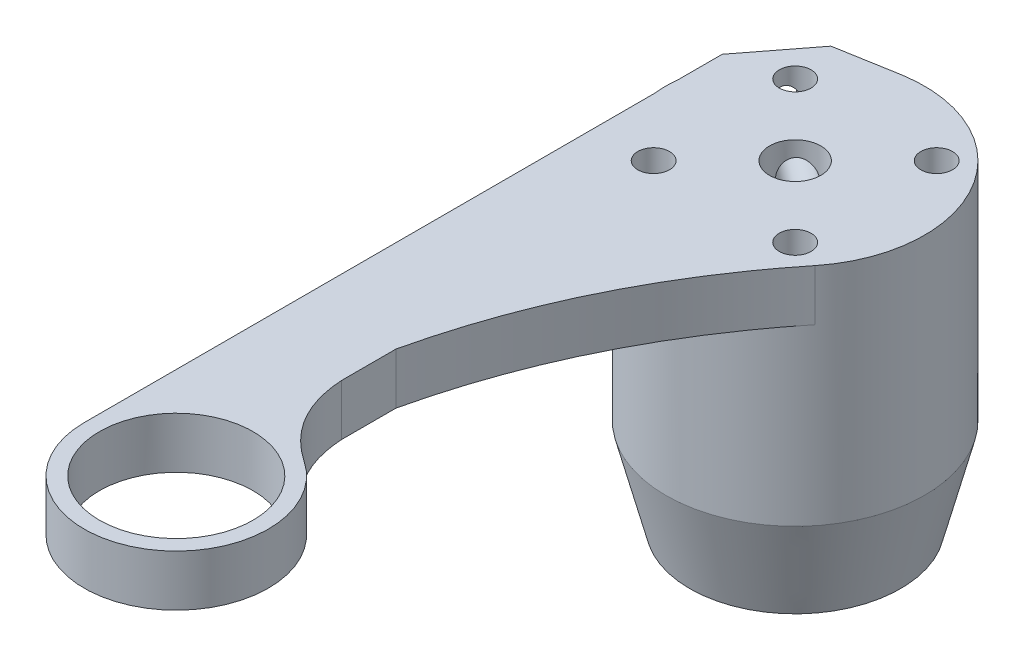
from build123d import *

# Parameters (mm, degrees)
DODANIE_WYCI_GNI_CIE1_DEPTH = 5
DODANIE_WYCI_GNI_CIE2_START = 17
SZKIC3_R                    = 12.625
DODANIE_WYCI_GNI_CIE2_DEPTH = 17
SZKIC4_R                    = 2.5
SZKIC4_R_2                  = 1.55
WYTNIJ_WYCI_GNI_CIE1_DEPTH  = 25
SZKIC5_R                    = 3.75
WYTNIJ_WYCI_GNI_CIE2_DEPTH  = 7.5
DODANIE_WYCI_GNI_CIE3_DEPTH = 15
SZKIC7_R                    = 1.5
WYTNIJ_WYCI_GNI_CIE3_DEPTH  = 14
SZKIC8_R                    = 7.5
WYTNIJ_WYCI_GNI_CIE4_DEPTH  = 14
SZKIC14_R                   = 12.625
SZKIC16_R                   = 10.3
SZKIC18_R                   = 3.75
WYTNIJ_WYCI_GNI_CIE5_DEPTH  = 7.5
SZKIC19_R                   = 0.7
WYTNIJ_WYCI_GNI_CIE6_DEPTH  = 5


with BuildPart() as part:
    # Szkic1 → Dodanie-wyciągnięcie1 (new body)
    with BuildSketch(Plane(origin=(0, 0, 0), x_dir=(1, 0, 0), z_dir=(0, 1, 0))):
        with BuildLine():
            Line((-9, 0), (-9, 55.600537222))
            ThreePointArc((-9, 55.600537222), (7.148204378, 68.984355181), (13.393573335, 48.962206087))
            add(Edge.make_bspline(
                [(0, 21.46), (3.478909601, 36.621824573), (13.393573335, 48.962206087)],
                knots=[0, 0, 0, 1, 1, 1], degree=2))
            Line((0, 21.46), (0, 16.16))
            add(Edge.make_bspline(
                [(0, 16.16), (0.310809708, 10.646673881), (5.027347184, 7.464970214)],
                knots=[0, 0, 0, 1, 1, 1], degree=2))
            ThreePointArc((5.027347184, 7.464970214), (4.228112779, -7.945002349), (-9, 0))
        make_face()
    extrude(amount=DODANIE_WYCI_GNI_CIE1_DEPTH)

    # Szkic3 → Dodanie-wyciągnięcie2 (add)
    with BuildSketch(Plane.XZ.offset(DODANIE_WYCI_GNI_CIE2_START)):
        with Locations(Location((3.56, -56.88, 0), (0, 0, 270))):
            Circle(SZKIC3_R)
    extrude(amount=-DODANIE_WYCI_GNI_CIE2_DEPTH)

    # Szkic4 → Wytnij-wyciągnięcie1 (cut)
    with BuildSketch(Plane.XZ.offset(17)):
        with Locations(Location((3.56, -56.88, 0), (0, 0, 270))):
            Circle(SZKIC4_R)
        with Locations(Location((-3.35, -49.97, 0), (0, 0, 270))):
            Circle(SZKIC4_R_2)
        with Locations(Location((10.47, -49.97, 0), (0, 0, 270))):
            Circle(SZKIC4_R_2)
        with Locations(Location((-3.35, -63.79, 0), (0, 0, 270))):
            Circle(SZKIC4_R_2)
        with Locations(Location((10.47, -63.79, 0), (0, 0, 270))):
            Circle(SZKIC4_R_2)
    extrude(amount=-WYTNIJ_WYCI_GNI_CIE1_DEPTH, mode=Mode.SUBTRACT)

    # Szkic5 → Wytnij-wyciągnięcie2 (cut)
    with BuildSketch(Plane.XZ.offset(17)):
        with Locations(Location((3.56, -56.88, 0), (0, 0, 270))):
            Circle(SZKIC5_R)
    extrude(amount=-WYTNIJ_WYCI_GNI_CIE2_DEPTH, mode=Mode.SUBTRACT)

    # Szkic6 → Dodanie-wyciągnięcie3 (add)
    with BuildSketch(Plane(origin=(0, 5, 0), x_dir=(1, 0, 0), z_dir=(0, 1, 0))):
        with BuildLine():
            Line((-9, 55.600537222), (-9, 62.310537222))
            Line((-9, 62.310537222), (-4.379377966, 68.310537222))
            Line((-4.379377966, 68.310537222), (1.560622034, 69.345677388))
            add(Edge.make_bspline(
                [(1.560622034, 69.345677388), (-7.284103586, 65.531370102), (-9, 55.600537222)],
                knots=[0, 0, 0, 1, 1, 1], degree=2))
        make_face()
    extrude(amount=-DODANIE_WYCI_GNI_CIE3_DEPTH)

    # Szkic7 → Wytnij-wyciągnięcie3 (cut)
    with BuildSketch(Plane(origin=(-35.771148282, 0, -27.547492656), x_dir=(-0.6101451639012687, 0, 0.7922896433551899), z_dir=(-0.7922896433551899, 0, -0.6101451639012687))):
        with Locations((-47.663180862, 2)):
            Circle(SZKIC7_R)
        with Locations((-47.663180862, -7)):
            Circle(SZKIC7_R)
    extrude(amount=-WYTNIJ_WYCI_GNI_CIE3_DEPTH, mode=Mode.SUBTRACT)

    # Szkic8 → Wytnij-wyciągnięcie4 (cut)
    with BuildSketch(Plane(origin=(0, 5, 0), x_dir=(1, 0, 0), z_dir=(0, 1, 0))):
        with Locations(Location((0, 0, 0), (0, 0, 270))):
            Circle(SZKIC8_R)
    extrude(amount=-WYTNIJ_WYCI_GNI_CIE4_DEPTH, mode=Mode.SUBTRACT)

    # Szkic14 → Wyciągnięcie po profilach3 section 0
    with BuildSketch(Plane.XZ.offset(17)):
        with Locations((3.56, -56.88)):
            Circle(SZKIC14_R)
    # Szkic16 → Wyciągnięcie po profilach3 section 1
    with BuildSketch(Plane(origin=(0, -26.05, 0), x_dir=(-1, 0, 0), z_dir=(0, -1, 0))):
        with Locations((-3.56, 56.88)):
            Circle(SZKIC16_R)
    loft()

    # Szkic18 → Wytnij-wyciągnięcie5 (cut)
    with BuildSketch(Plane.XZ.offset(26.05)):
        with Locations(Location((3.56, -56.88, 0), (0, 0, 270))):
            Circle(SZKIC18_R)
    extrude(amount=-WYTNIJ_WYCI_GNI_CIE5_DEPTH, mode=Mode.SUBTRACT)

    # Szkic19 → Wytnij-wyciągnięcie6 (cut)
    with BuildSketch(Plane.XZ.offset(26.05)):
        with Locations(Location((-3.68, -53.48, 0), (0, 0, 270))):
            Circle(SZKIC19_R)
        with Locations(Location((-3.68, -56.88, 0), (0, 0, 270))):
            Circle(SZKIC19_R)
        with Locations(Location((-3.68, -60.28, 0), (0, 0, 270))):
            Circle(SZKIC19_R)
        with Locations(Location((0.16, -64.12, 0), (0, 0, 270))):
            Circle(SZKIC19_R)
        with Locations(Location((3.56, -64.12, 0), (0, 0, 270))):
            Circle(SZKIC19_R)
        with Locations(Location((6.96, -64.12, 0), (0, 0, 270))):
            Circle(SZKIC19_R)
        with Locations(Location((10.8, -60.28, 0), (0, 0, 270))):
            Circle(SZKIC19_R)
        with Locations(Location((10.8, -56.88, 0), (0, 0, 270))):
            Circle(SZKIC19_R)
        with Locations(Location((10.8, -53.639400789, 0), (0, 0, 270))):
            Circle(SZKIC19_R)
        with Locations(Location((6.96, -49.64, 0), (0, 0, 270))):
            Circle(SZKIC19_R)
        with Locations(Location((3.56, -49.64, 0), (0, 0, 270))):
            Circle(SZKIC19_R)
        with Locations(Location((0.16, -49.64, 0), (0, 0, 270))):
            Circle(SZKIC19_R)
    extrude(amount=-WYTNIJ_WYCI_GNI_CIE6_DEPTH, mode=Mode.SUBTRACT)


solid = part.part
